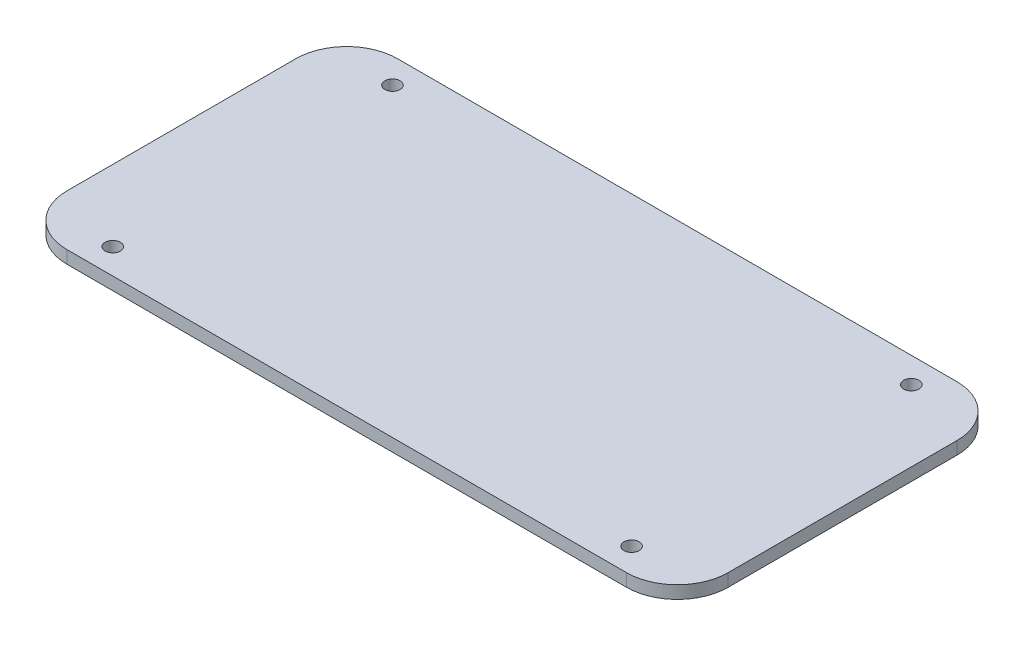
from build123d import *

# Parameters (mm, degrees)
BOSS_EXTRUDE1_DEPTH = 2.5
SKETCH2_R           = 1.5
CUT_EXTRUDE1_DEPTH  = 146.365917601


with BuildPart() as part:
    # Sketch1 → Boss-Extrude1 (new body)
    with BuildSketch(Plane(origin=(0, 0, 0), x_dir=(1, 0, 0), z_dir=(0, 1, 0))):
        with BuildLine():
            Line((10, 0), (120, 0))
            ThreePointArc((120, 0), (127.071067812, 2.928932188), (130, 10))
            Line((130, 10), (130, 55))
            ThreePointArc((130, 55), (127.071067812, 62.071067812), (120, 65))
            Line((120, 65), (10, 65))
            ThreePointArc((10, 65), (2.928932188, 62.071067812), (0, 55))
            Line((0, 55), (0, 10))
            ThreePointArc((0, 10), (2.928932188, 2.928932188), (10, 0))
        make_face()
    extrude(amount=BOSS_EXTRUDE1_DEPTH)

    # Sketch2 → Cut-Extrude1 (cut, through all)
    with BuildSketch(Plane(origin=(0, 2.5, 0), x_dir=(1, 0, 0), z_dir=(0, 1, 0))):
        with Locations(Location((14, 5, 0), (0, 0, 270))):
            Circle(SKETCH2_R)
        with Locations(Location((14, 60, 0), (0, 0, 270))):
            Circle(SKETCH2_R)
        with Locations(Location((116, 5, 0), (0, 0, 90))):
            Circle(SKETCH2_R)
        with Locations(Location((116, 60, 0), (0, 0, 90))):
            Circle(SKETCH2_R)
    extrude(amount=-CUT_EXTRUDE1_DEPTH, mode=Mode.SUBTRACT)


solid = part.part
